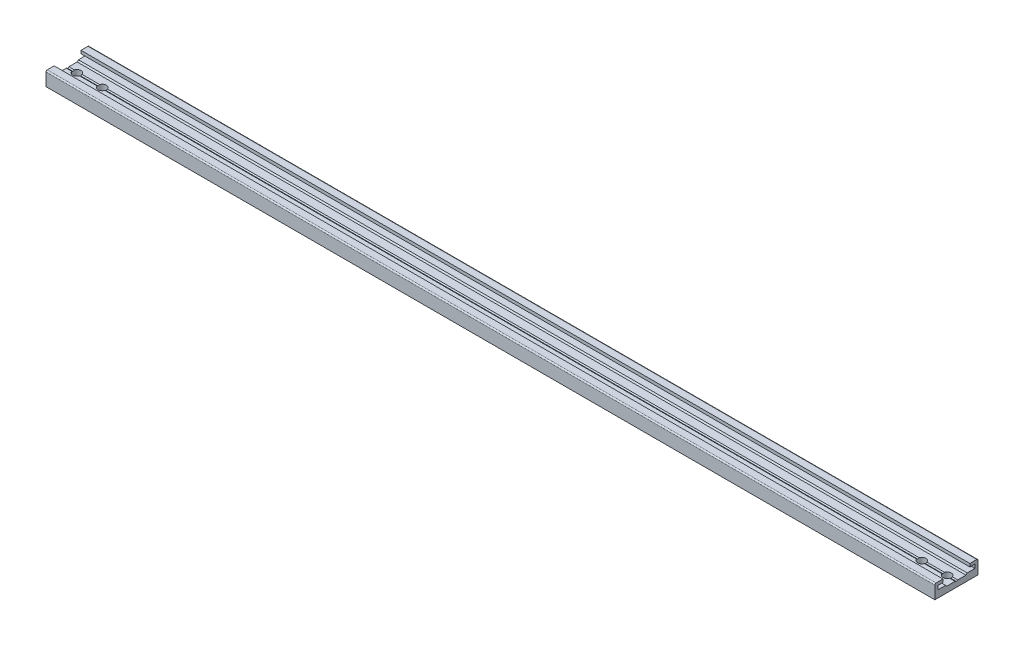
from build123d import *

# Parameters (mm, degrees)
BOSS_EXTRUDE1_DEPTH = 350
SKETCH6_R           = 1.6
CUT_EXTRUDE1_DEPTH  = 351.117823025


with BuildPart() as part:
    # Sketch5 → Boss-Extrude1 (new body)
    with BuildSketch(Plane(origin=(0, 0, 0), x_dir=(0, 0, -1), z_dir=(1, 0, 0))):
        with BuildLine():
            Line((-8.499999996, -2.75), (8.499999996, -2.75))
            Line((8.499999996, -2.75), (8.499999996, 2.25))
            ThreePointArc((8.499999996, 2.25), (8.353553387, 2.603553391), (7.999999996, 2.75))
            Line((7.999999996, 2.75), (5.299999996, 2.75))
            Line((5.299999996, 2.75), (5.299999996, 1.55))
            Line((5.299999996, 1.55), (7.299999998, 1.55))
            Line((7.299999998, 1.55), (7.299999998, 0.05))
            Line((7.299999998, 0.05), (4.249999998, 0.05))
            Line((4.249999998, 0.05), (3.749999998, -0.45))
            Line((3.749999998, -0.45), (0.499999998, -0.45))
            Line((0.499999998, -0.45), (0, -0.738675133))
            Line((0, -0.738675133), (-0.499999998, -0.45))
            Line((-0.499999998, -0.45), (-3.749999998, -0.45))
            Line((-3.749999998, -0.45), (-4.249999998, 0.05))
            Line((-4.249999998, 0.05), (-7.299999998, 0.05))
            Line((-7.299999998, 0.05), (-7.299999998, 1.55))
            Line((-7.299999998, 1.55), (-5.299999996, 1.55))
            Line((-5.299999996, 1.55), (-5.299999996, 2.75))
            Line((-5.299999996, 2.75), (-7.999999996, 2.75))
            ThreePointArc((-7.999999996, 2.75), (-8.353553387, 2.603553391), (-8.499999996, 2.25))
            Line((-8.499999996, 2.25), (-8.499999996, -2.75))
        make_face()
    extrude(amount=BOSS_EXTRUDE1_DEPTH)

    # Sketch6 → Cut-Extrude1 (cut, through all)
    with BuildSketch(Plane(origin=(0, -0.45, 0), x_dir=(1, 0, 0), z_dir=(0, 1, 0))):
        with Locations(Location((13.647499996, 4e-09, 0), (0, 0, 270))):
            Circle(SKETCH6_R)
        with Locations(Location((3.647499996, 4e-09, 0), (0, 0, 270))):
            Circle(SKETCH6_R)
        with Locations(Location((346.352500004, 4e-09, 0), (0, 0, 270))):
            Circle(SKETCH6_R)
        with Locations(Location((336.352500004, 4e-09, 0), (0, 0, 270))):
            Circle(SKETCH6_R)
    extrude(amount=-CUT_EXTRUDE1_DEPTH, mode=Mode.SUBTRACT)


solid = part.part
